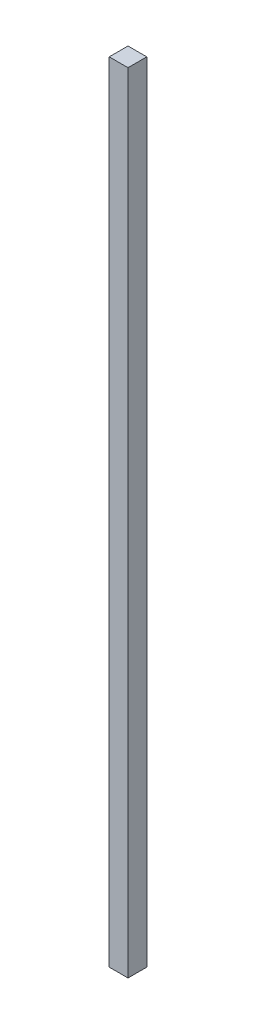
from build123d import *

# Parameters (mm, degrees)
OVEN_FIRIN_ARKA_KANAL_KABLO_1_START = -760
SKETCH1_W                           = 40
SKETCH1_H                           = 1680
OVEN_FIRIN_ARKA_KANAL_KABLO_1_DEPTH = 40


with BuildPart() as part:
    # Sketch1 → OVEN_firin_arka_kanal_kablo_1 (new body)
    with BuildSketch(Plane.XY.offset(OVEN_FIRIN_ARKA_KANAL_KABLO_1_START)):
        with Locations((640, 960)):
            Rectangle(SKETCH1_W, SKETCH1_H)
    extrude(amount=-OVEN_FIRIN_ARKA_KANAL_KABLO_1_DEPTH)


solid = part.part
